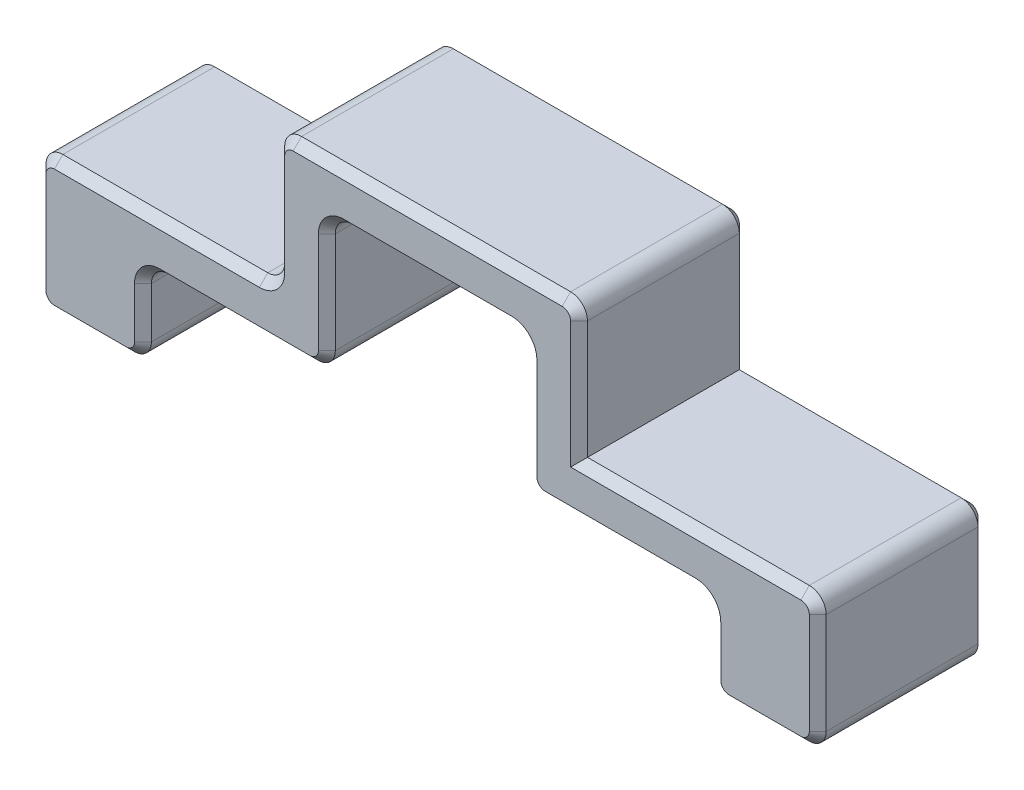
from build123d import *

# Parameters (mm, degrees)
BOSS_EXTRUDE1_DEPTH = 10
FILLET1_R           = 1
CHAMFER1_SIZE       = 0.5


with BuildPart() as part:
    # Sketch1 → Boss-Extrude1 (new body)
    with BuildSketch(Plane.XY):
        Polygon((-5.975, 0), (-5.975, 8), (5.975, 8), (5.975, 0), (16.875, 0), (16.875, -5), (23.125, -5), (23.125, 0), (23.125, 3), (8.975, 3), (8.975, 11), (-8.975, 11), (-8.975, 3), (-23.125, 3), (-23.125, 0), (-23.125, -5), (-16.875, -5), (-16.875, 0), align=None)
    extrude(amount=BOSS_EXTRUDE1_DEPTH)

    # Fillet1
    fillet1_edges = [part.edges().sort_by_distance(p)[0] for p in [
        (-16.875, 0, 5),
        (-16.875, -5, 5),
        (-23.125, -5, 5),
        (-23.125, 3, 5),
        (-8.975, 3, 5),
        (-8.975, 11, 5),
        (8.975, 11, 5),
        (23.125, 3, 5),
        (23.125, -5, 5),
        (16.875, -5, 5),
        (16.875, 0, 5),
        (5.975, 0, 5),
        (5.975, 8, 5),
        (-5.975, 8, 5),
        (-5.975, 0, 5),
    ]]
    fillet(fillet1_edges, radius=FILLET1_R)

    # Chamfer1
    chamfer1_edges = [part.edges().sort_by_distance(p)[0] for p in [
        (16.582106781, -0.292893219, 0),
        (16.582106781, -0.292893219, 10),
        (-5.682106781, 7.707106781, 0),
        (-5.682106781, 7.707106781, 10),
        (5.682106781, 7.707106781, 0),
        (5.682106781, 7.707106781, 10),
        (-9.267893219, 3.292893219, 0),
        (-9.267893219, 3.292893219, 10),
        (-16.582106781, -0.292893219, 0),
        (-16.582106781, -0.292893219, 10),
        (8.975, 6.5, 0),
        (8.975, 6.5, 10),
        (15.55, 3, 0),
        (15.55, 3, 10),
        (-11.425, 0, 0),
        (-16.875, -2.5, 0),
        (-20, -5, 0),
        (-23.125, -1, 0),
        (-16.05, 3, 0),
        (-8.975, 7, 0),
        (0, 11, 0),
        (23.125, -1, 0),
        (20, -5, 0),
        (16.875, -2.5, 0),
        (11.425, 0, 0),
        (5.975, 4, 0),
        (0, 8, 0),
        (-5.975, 4, 0),
        (-22.832106781, -4.707106781, 0),
        (-17.167893219, -4.707106781, 0),
        (-22.832106781, 2.707106781, 0),
        (-8.682106781, 10.707106781, 0),
        (8.682106781, 10.707106781, 0),
        (-6.267893219, 0.292893219, 0),
        (6.267893219, 0.292893219, 0),
        (17.167893219, -4.707106781, 0),
        (22.832106781, -4.707106781, 0),
        (22.832106781, 2.707106781, 0),
        (23.125, -1, 10),
        (-11.425, 0, 10),
        (-5.975, 4, 10),
        (0, 8, 10),
        (5.975, 4, 10),
        (11.425, 0, 10),
        (16.875, -2.5, 10),
        (20, -5, 10),
        (0, 11, 10),
        (-8.975, 7, 10),
        (-16.05, 3, 10),
        (-23.125, -1, 10),
        (-20, -5, 10),
        (-16.875, -2.5, 10),
        (-22.832106781, -4.707106781, 10),
        (-17.167893219, -4.707106781, 10),
        (-22.832106781, 2.707106781, 10),
        (-8.682106781, 10.707106781, 10),
        (8.682106781, 10.707106781, 10),
        (-6.267893219, 0.292893219, 10),
        (6.267893219, 0.292893219, 10),
        (17.167893219, -4.707106781, 10),
        (22.832106781, -4.707106781, 10),
        (22.832106781, 2.707106781, 10),
    ]]
    chamfer(chamfer1_edges, length=CHAMFER1_SIZE)


solid = part.part
